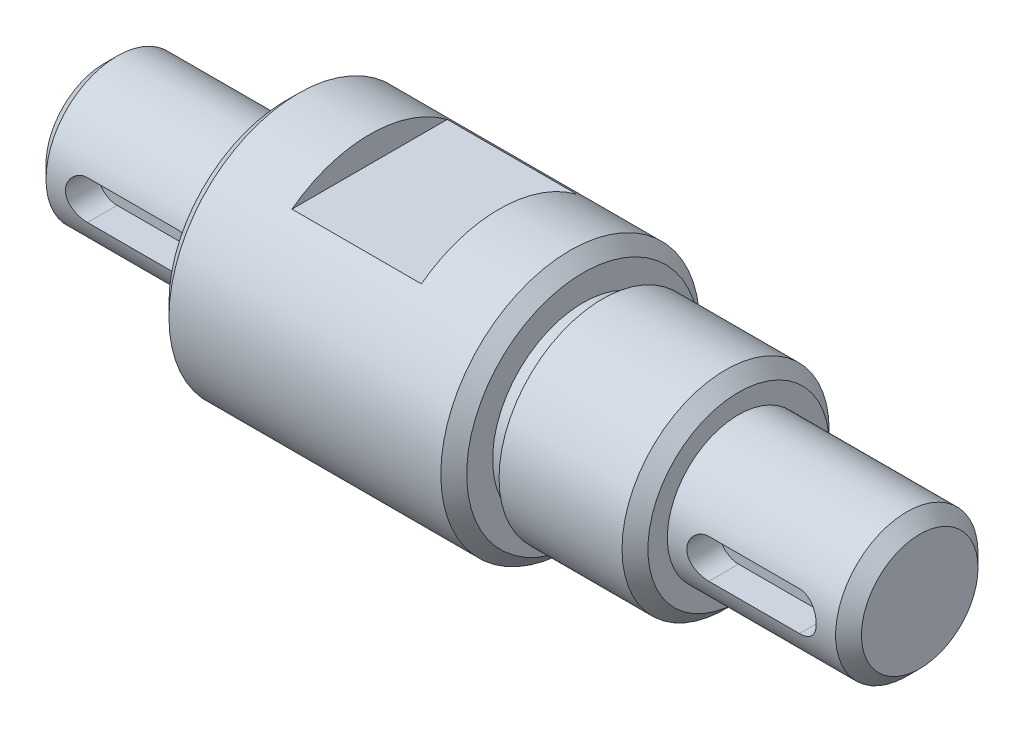
from build123d import *

# Parameters (mm, degrees)
SKETCH1_R               = 20
BOSS_EXTRUDE1_DEPTH     = 126
SKETCH2_OUTSIDE_W       = 69.624
SKETCH2_OUTSIDE_H       = 69.624
SKETCH2_OUTSIDE_R       = 11
CUT_EXTRUDE1_DEPTH      = 28
SKETCH3_OUTSIDE_W       = 69.624
SKETCH3_OUTSIDE_H       = 69.624
SKETCH3_OUTSIDE_R       = 11
CUT_EXTRUDE2_DEPTH      = 28
SKETCH4_OUTSIDE_W       = 69.624
SKETCH4_OUTSIDE_H       = 69.624
SKETCH4_OUTSIDE_R       = 16
CUT_EXTRUDE3_DEPTH      = 21
SKETCH5_OUTSIDE_W       = 69.624
SKETCH5_OUTSIDE_H       = 69.624
SKETCH5_OUTSIDE_R       = 14
CUT_EXTRUDE4_DEPTH      = 3
CHAMFER1_SIZE           = 2
CUT_EXTRUDE5_DEPTH      = 130.135587659
CUT_EXTRUDE5_DEPTH_BACK = 130.135587659
SKETCH6_W               = 20
SKETCH6_H               = 6
CUT_EXTRUDE6_DEPTH      = 5


with BuildPart() as part:
    # Sketch1 → Boss-Extrude1 (new body)
    with BuildSketch(Plane(origin=(0, 0, 0), x_dir=(0, 0, -1), z_dir=(1, 0, 0))):
        Circle(SKETCH1_R)
    extrude(amount=BOSS_EXTRUDE1_DEPTH)

    # Sketch2 outside → Cut-Extrude1 (cut)
    with BuildSketch(Plane.ZY):
        Rectangle(SKETCH2_OUTSIDE_W, SKETCH2_OUTSIDE_H)
        Circle(SKETCH2_OUTSIDE_R, mode=Mode.SUBTRACT)
    extrude(amount=-CUT_EXTRUDE1_DEPTH, mode=Mode.SUBTRACT)

    # Sketch3 outside → Cut-Extrude2 (cut)
    with BuildSketch(Plane(origin=(126, 0, 0), x_dir=(0, 0, -1), z_dir=(1, 0, 0))):
        Rectangle(SKETCH3_OUTSIDE_W, SKETCH3_OUTSIDE_H)
        with Locations(Location((0, 0, 0), (0, 0, 180))):
            Circle(SKETCH3_OUTSIDE_R, mode=Mode.SUBTRACT)
    extrude(amount=-CUT_EXTRUDE2_DEPTH, mode=Mode.SUBTRACT)

    # Sketch4 outside → Cut-Extrude3 (cut)
    with BuildSketch(Plane(origin=(98, 0, 0), x_dir=(0, 0, -1), z_dir=(1, 0, 0))):
        Rectangle(SKETCH4_OUTSIDE_W, SKETCH4_OUTSIDE_H)
        Circle(SKETCH4_OUTSIDE_R, mode=Mode.SUBTRACT)
    extrude(amount=-CUT_EXTRUDE3_DEPTH, mode=Mode.SUBTRACT)

    # Sketch5 outside → Cut-Extrude4 (cut)
    with BuildSketch(Plane(origin=(77, 0, 0), x_dir=(0, 0, -1), z_dir=(1, 0, 0))):
        Rectangle(SKETCH5_OUTSIDE_W, SKETCH5_OUTSIDE_H)
        Circle(SKETCH5_OUTSIDE_R, mode=Mode.SUBTRACT)
    extrude(amount=-CUT_EXTRUDE4_DEPTH, mode=Mode.SUBTRACT)

    # Chamfer1
    chamfer1_edges = [part.edges().sort_by_distance(p)[0] for p in [
        (0, 0, -11),
        (126, 0, -11),
        (98, 0, 16),
        (74, 0, 20),
        (28, 0, 20),
    ]]
    chamfer(chamfer1_edges, length=CHAMFER1_SIZE)

    # Sketch6 → Cut-Extrude5 (cut, two sides: drawn at the far end of the back side and taken through both)
    with BuildSketch(Plane.XY.offset(-CUT_EXTRUDE5_DEPTH_BACK)):
        with Locations((51, 19)):
            Rectangle(SKETCH6_W, SKETCH6_H)
    extrude(amount=CUT_EXTRUDE5_DEPTH + CUT_EXTRUDE5_DEPTH_BACK, mode=Mode.SUBTRACT)

    # Sketch7 → Cut-Extrude6 (cut)
    with BuildSketch(Plane.XY.offset(11)):
        with BuildLine():
            Line((8, 3), (22, 3))
            ThreePointArc((22, 3), (25, 0), (22, -3))
            Line((22, -3), (8, -3))
            ThreePointArc((8, -3), (5, 0), (8, 3))
        make_face()
        with BuildLine():
            Line((104, 3), (118, 3))
            ThreePointArc((118, 3), (121, 0), (118, -3))
            Line((118, -3), (104, -3))
            ThreePointArc((104, -3), (101, 0), (104, 3))
        make_face()
    extrude(amount=-CUT_EXTRUDE6_DEPTH, mode=Mode.SUBTRACT)


solid = part.part
